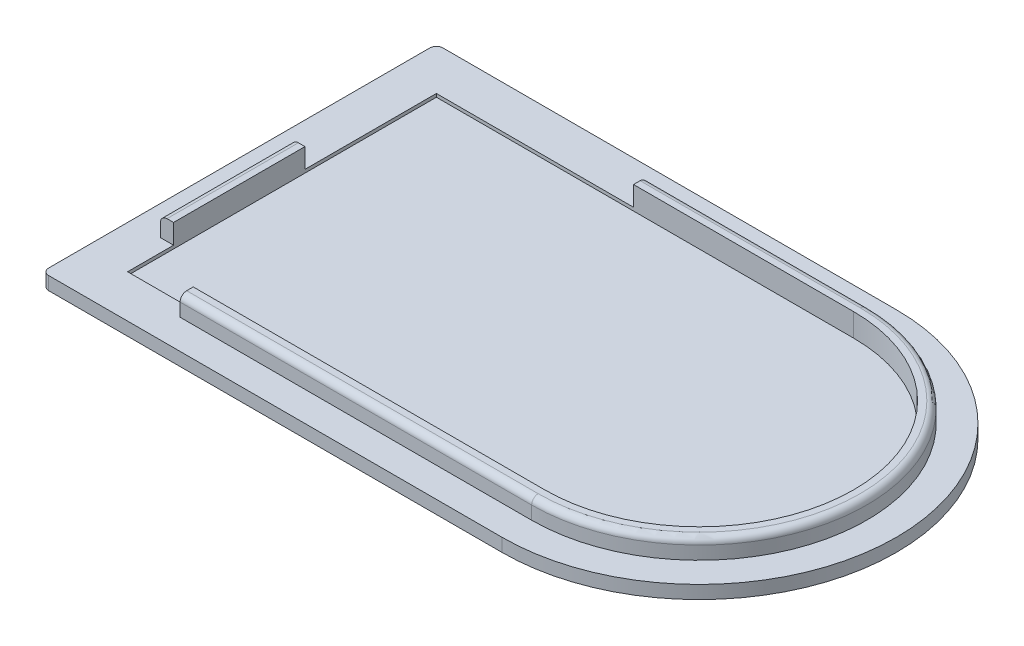
from build123d import *

# Parameters (mm, degrees)
BOSS_EXTRUDE1_DEPTH = 3
BOSS_EXTRUDE2_START = 2
BOSS_EXTRUDE2_DEPTH = 2
CUT_EXTRUDE1_DEPTH  = 3.5
FILLET1_R           = 1
SKETCH5_W           = 12
SKETCH5_H           = 9
SKETCH5_W_2         = 32
SKETCH5_H_2         = 22
CUT_EXTRUDE4_DEPTH  = 3
FILLET8_R           = 1
FILLET9_R           = 1


with BuildPart() as part:
    # Sketch1 → Boss-Extrude1 (new body)
    with BuildSketch(Plane(origin=(0, 0, 0), x_dir=(1, 0, 0), z_dir=(0, 1, 0))):
        with BuildLine():
            Line((-65.5, -25.5), (0, -25.5))
            ThreePointArc((0, -25.5), (25.5, 0), (0, 25.5))
            Line((0, 25.5), (-65.5, 25.5))
            Line((-65.5, 25.5), (-65.5, -25.5))
        make_face()
    extrude(amount=BOSS_EXTRUDE1_DEPTH)

    # Sketch2 → Boss-Extrude2 (add)
    # profile 1 of 2: a face of its own
    with BuildSketch(Plane.XZ.offset(BOSS_EXTRUDE2_START)):
        with BuildLine():
            Line((-70, -30), (0, -30))
            ThreePointArc((0, -30), (30, 0), (0, 30))
            Line((0, 30), (-70, 30))
            Line((-70, 30), (-70, -30))
        make_face()
        with BuildLine():
            Line((0, 25.5), (-65.5, 25.5))
            Line((-65.5, 25.5), (-65.5, -25.5))
            Line((-65.5, -25.5), (0, -25.5))
            ThreePointArc((0, -25.5), (25.5, 0), (0, 25.5))
        make_face(mode=Mode.SUBTRACT)
    # profile 2 of 2: a face of its own
    with BuildSketch(Plane.XZ.offset(BOSS_EXTRUDE2_START)):
        with BuildLine():
            ThreePointArc((0, -25.5), (25.5, 0), (0, 25.5))
            Line((0, 25.5), (-65.5, 25.5))
            Line((-65.5, 25.5), (-65.5, -25.5))
            Line((-65.5, -25.5), (0, -25.5))
        make_face()
    extrude(amount=-BOSS_EXTRUDE2_DEPTH)

    # Sketch4 → Cut-Extrude1 (cut)
    with BuildSketch(Plane(origin=(0, 3, 0), x_dir=(1, 0, 0), z_dir=(0, 1, 0))):
        with BuildLine():
            Line((-63.5, -23.5), (0, -23.5))
            ThreePointArc((0, -23.5), (23.5, 0), (0, 23.5))
            Line((0, 23.5), (-63.5, 23.5))
            Line((-63.5, 23.5), (-63.5, -23.5))
        make_face()
    extrude(amount=-CUT_EXTRUDE1_DEPTH, mode=Mode.SUBTRACT)

    # Fillet1
    fillet1_edges = [part.edges().sort_by_distance(p)[0] for p in [
        (-70, -1, -30),
        (-70, -1, 30),
    ]]
    fillet(fillet1_edges, radius=FILLET1_R)

    # Sketch5 → Cut-Extrude4 (cut)
    with BuildSketch(Plane(origin=(0, 3, 0), x_dir=(1, 0, 0), z_dir=(0, 1, 0))):
        with Locations((-59.5, -21)):
            Rectangle(SKETCH5_W, SKETCH5_H)
        with Locations((-49.5, 14.5)):
            Rectangle(SKETCH5_W_2, SKETCH5_H_2)
    extrude(amount=-CUT_EXTRUDE4_DEPTH, mode=Mode.SUBTRACT)

    # Fillet8
    fillet8_edges = [part.edges().sort_by_distance(p)[0] for p in [
        (-65.5, 3, 6.5),
    ]]
    fillet(fillet8_edges, radius=FILLET8_R)

    # Fillet9
    fillet9_edges = [part.edges().sort_by_distance(p)[0] for p in [
        (25.5, 3, 0),
        (-16.75, 3, -25.5),
        (-26.75, 3, 25.5),
    ]]
    fillet(fillet9_edges, radius=FILLET9_R)


solid = part.part
